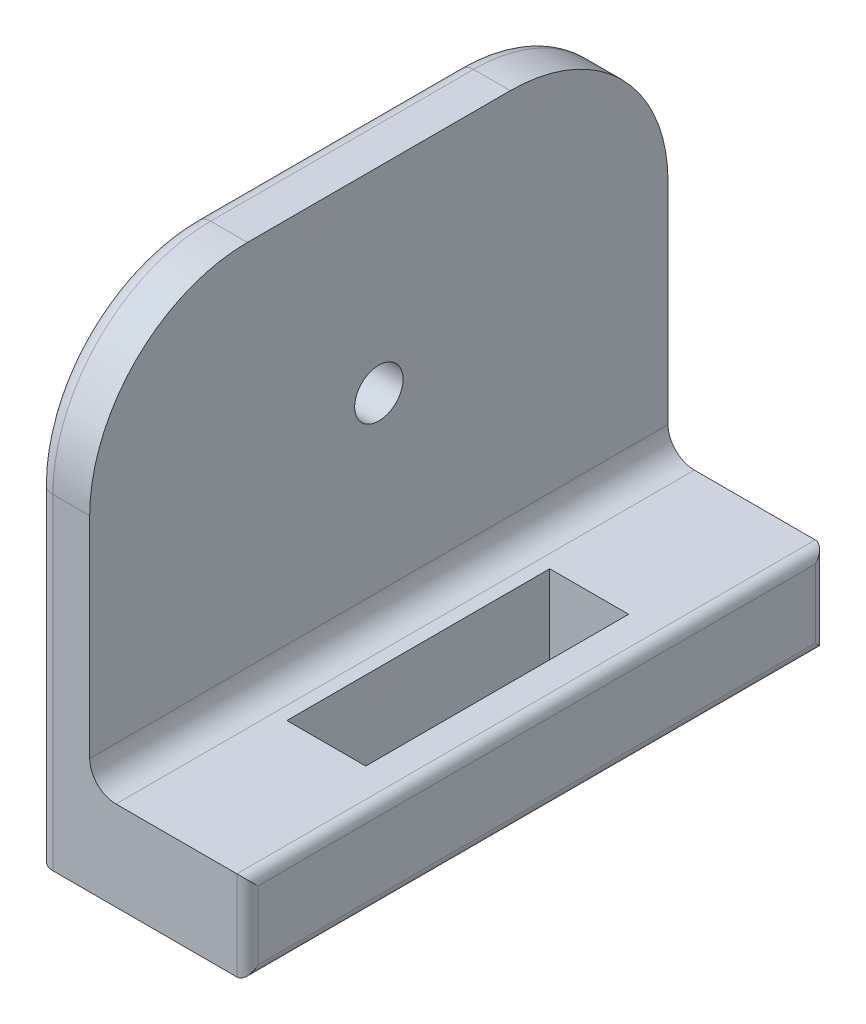
from build123d import *

# Parameters (mm, degrees)
SKETCH1_W           = 40
SKETCH1_H           = 110
BOSS_EXTRUDE1_DEPTH = 17
SKETCH4_W           = 110
SKETCH4_H           = 75
BOSS_EXTRUDE2_DEPTH = 10
SKETCH5_W           = 15
SKETCH5_H           = 50
CUT_EXTRUDE1_DEPTH  = 17
SKETCH6_R           = 4.6
CUT_EXTRUDE2_DEPTH  = 10
FILLET1_R           = 30
FILLET2_R           = 3
FILLET3_R           = 5
FILLET4_R           = 2


with BuildPart() as part:
    # Sketch1 → Boss-Extrude1 (new body)
    with BuildSketch(Plane(origin=(0, 0, 0), x_dir=(1, 0, 0), z_dir=(0, 1, 0))):
        with Locations((20, 55)):
            Rectangle(SKETCH1_W, SKETCH1_H)
    extrude(amount=BOSS_EXTRUDE1_DEPTH)

    # Sketch4 → Boss-Extrude2 (add)
    with BuildSketch(Plane(origin=(0, 0, 0), x_dir=(0, 0, -1), z_dir=(1, 0, 0))):
        with Locations((55, 54.5)):
            Rectangle(SKETCH4_W, SKETCH4_H)
    extrude(amount=BOSS_EXTRUDE2_DEPTH)

    # Sketch5 → Cut-Extrude1 (cut)
    with BuildSketch(Plane(origin=(0, 17, 0), x_dir=(1, 0, 0), z_dir=(0, 1, 0))):
        with Locations((25, 55)):
            Rectangle(SKETCH5_W, SKETCH5_H)
    extrude(amount=-CUT_EXTRUDE1_DEPTH, mode=Mode.SUBTRACT)

    # Sketch6 → Cut-Extrude2 (cut)
    with BuildSketch(Plane(origin=(10, 0, 0), x_dir=(0, 0, -1), z_dir=(1, 0, 0))):
        with Locations((55, 54.7)):
            Circle(SKETCH6_R)
    extrude(amount=-CUT_EXTRUDE2_DEPTH, mode=Mode.SUBTRACT)

    # Fillet1
    fillet1_edges = [part.edges().sort_by_distance(p)[0] for p in [
        (5, 92, 0),
        (5, 92, -110),
    ]]
    fillet(fillet1_edges, radius=FILLET1_R)

    # Fillet2
    fillet2_edges = [part.edges().sort_by_distance(p)[0] for p in [
        (0, 31, 0),
        (0, 92, -55),
        (0, 31, -110),
        (0, 83.213203436, -101.213203436),
        (0, 83.213203436, -8.786796564),
    ]]
    fillet(fillet2_edges, radius=FILLET2_R)

    # Fillet3
    fillet3_edges = [part.edges().sort_by_distance(p)[0] for p in [
        (10, 17, -55),
    ]]
    fillet(fillet3_edges, radius=FILLET3_R)

    # Fillet4
    fillet4_edges = [part.edges().sort_by_distance(p)[0] for p in [
        (40, 17, -55),
        (40, 0, -55),
        (40, 8.5, -110),
        (40, 8.5, 0),
    ]]
    fillet(fillet4_edges, radius=FILLET4_R)


solid = part.part
